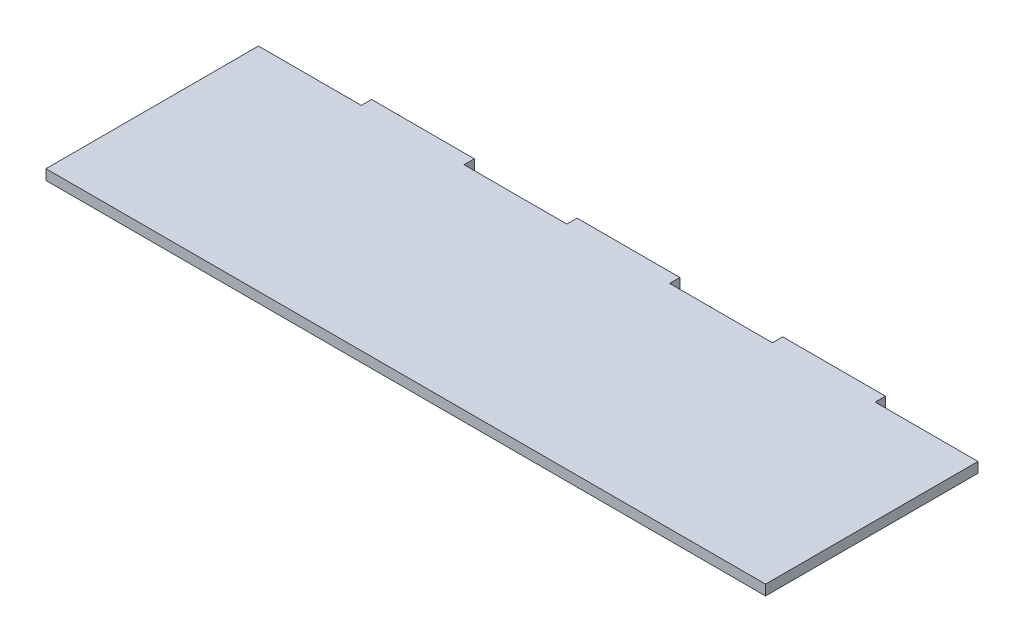
from build123d import *

# Parameters (mm, degrees)
SKETCH1_W           = 210
SKETCH1_H           = 65
BOSS_EXTRUDE1_DEPTH = 3
SKETCH2_W           = 30
SKETCH2_H           = 3
CUT_EXTRUDE1_DEPTH  = 5


with BuildPart() as part:
    # Sketch1 → Boss-Extrude1 (new body)
    with BuildSketch(Plane(origin=(0, 0, 0), x_dir=(1, 0, 0), z_dir=(0, 1, 0))):
        with Locations((105, 32.5)):
            Rectangle(SKETCH1_W, SKETCH1_H)
    extrude(amount=BOSS_EXTRUDE1_DEPTH)

    # Sketch2 → Cut-Extrude1 (cut)
    with BuildSketch(Plane(origin=(0, 3, 0), x_dir=(1, 0, 0), z_dir=(0, 1, 0))):
        with Locations((15, 63.5)):
            Rectangle(SKETCH2_W, SKETCH2_H)
        with Locations((75, 63.5)):
            Rectangle(SKETCH2_W, SKETCH2_H)
        with Locations((135, 63.5)):
            Rectangle(SKETCH2_W, SKETCH2_H)
        with Locations((195, 63.5)):
            Rectangle(SKETCH2_W, SKETCH2_H)
    extrude(amount=-CUT_EXTRUDE1_DEPTH, mode=Mode.SUBTRACT)


solid = part.part
